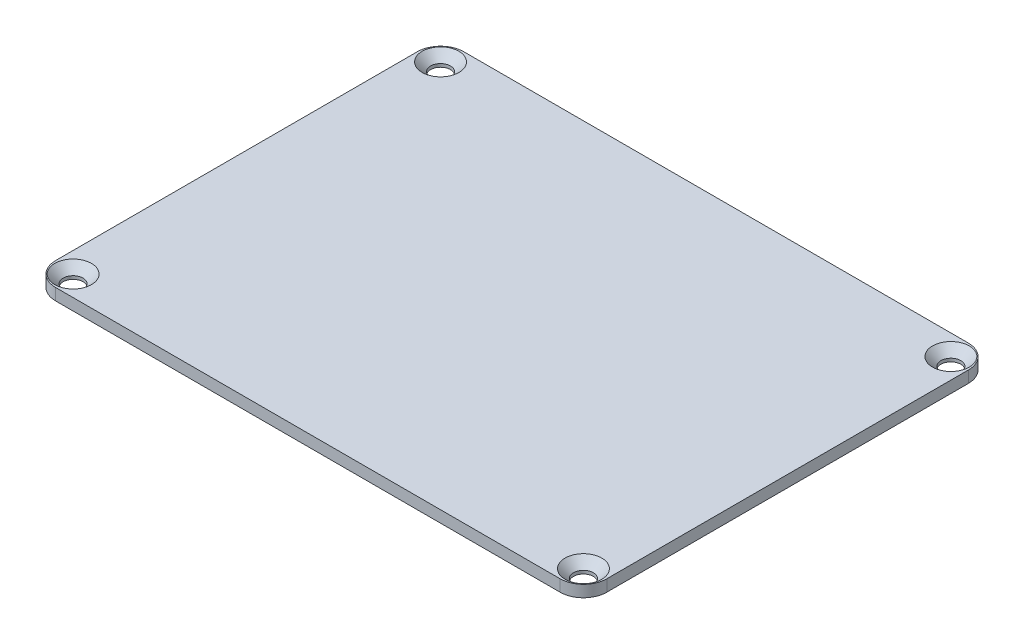
from build123d import *

# Parameters (mm, degrees)
SKETCH1_W                                       = 94.5
SKETCH1_H                                       = 70
BOSS_EXTRUDE1_DEPTH                             = 2
CSK_FOR_M3_FLAT_HEAD_MACHINE_SCREW1_D           = 3.4
CSK_FOR_M3_FLAT_HEAD_MACHINE_SCREW1_DEPTH       = 30
CSK_FOR_M3_FLAT_HEAD_MACHINE_SCREW1_CSINK_D     = 6.3
CSK_FOR_M3_FLAT_HEAD_MACHINE_SCREW1_CSINK_ANGLE = 90
CSK_FOR_M3_FLAT_HEAD_MACHINE_SCREW1_TIP         = 1.021463052
FILLET1_R                                       = 4


with BuildPart() as part:
    # Sketch1 → Boss-Extrude1 (new body)
    with BuildSketch(Plane(origin=(0, 0, 0), x_dir=(1, 0, 0), z_dir=(0, 1, 0))):
        Rectangle(SKETCH1_W, SKETCH1_H)
    extrude(amount=-BOSS_EXTRUDE1_DEPTH)

    # CSK for M3 Flat Head Machine Screw1
    with Locations(Plane(origin=(-43.75, 0, -31.5), x_dir=(0, 0, 1), z_dir=(0, 1, 0))):
        with Locations((0, 0), (0, 87.5), (63, 87.5), (63, 0)):
            CounterSinkHole(CSK_FOR_M3_FLAT_HEAD_MACHINE_SCREW1_D / 2, CSK_FOR_M3_FLAT_HEAD_MACHINE_SCREW1_CSINK_D / 2, depth=CSK_FOR_M3_FLAT_HEAD_MACHINE_SCREW1_DEPTH, counter_sink_angle=CSK_FOR_M3_FLAT_HEAD_MACHINE_SCREW1_CSINK_ANGLE)
            with Locations((0, 0, -(CSK_FOR_M3_FLAT_HEAD_MACHINE_SCREW1_DEPTH + CSK_FOR_M3_FLAT_HEAD_MACHINE_SCREW1_TIP / 2))):  # 118° drill point
                Cone(0, CSK_FOR_M3_FLAT_HEAD_MACHINE_SCREW1_D / 2, CSK_FOR_M3_FLAT_HEAD_MACHINE_SCREW1_TIP, mode=Mode.SUBTRACT)

    # Fillet1
    fillet1_edges = [part.edges().sort_by_distance(p)[0] for p in [
        (47.25, -1, 35),
        (-47.25, -1, 35),
        (-47.25, -1, -35),
        (47.25, -1, -35),
    ]]
    fillet(fillet1_edges, radius=FILLET1_R)


solid = part.part
